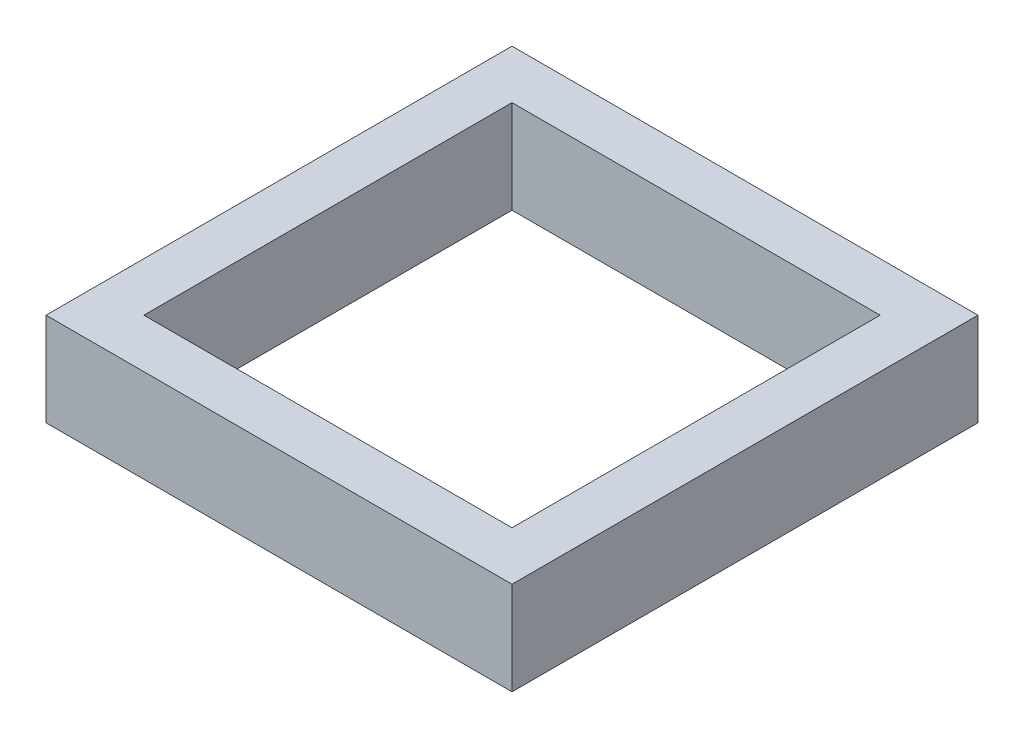
from build123d import *

# Parameters (mm, degrees)
CROQUIS1_W              = 200
CROQUIS1_H              = 200
CROQUIS1_W_2            = 158
CROQUIS1_H_2            = 158
SALIENTE_EXTRUIR1_DEPTH = 40


with BuildPart() as part:
    # Croquis1 → Saliente-Extruir1 (new body)
    with BuildSketch(Plane(origin=(0, 0, 0), x_dir=(1, 0, 0), z_dir=(0, 1, 0))):
        Rectangle(CROQUIS1_W, CROQUIS1_H)
        Rectangle(CROQUIS1_W_2, CROQUIS1_H_2, mode=Mode.SUBTRACT)
    extrude(amount=SALIENTE_EXTRUIR1_DEPTH)


solid = part.part
